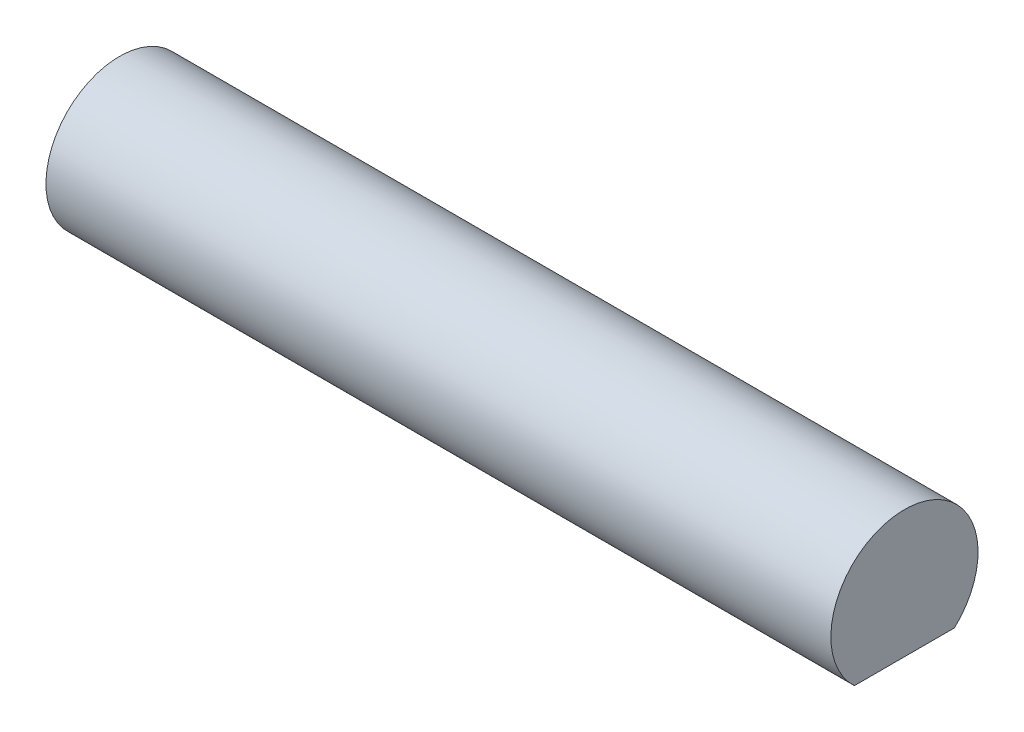
from build123d import *

# Parameters (mm, degrees)
BOSS_EXTRUDE1_DEPTH = 8


with BuildPart() as part:
    # Sketch1 → Boss-Extrude1 (new, symmetric)
    with BuildSketch(Plane(origin=(0, 0, 0), x_dir=(0, 0, -1), z_dir=(1, 0, 0))):
        with BuildLine():
            Line((-1.019803903, -1.1), (1.019803903, -1.1))
            ThreePointArc((1.019803903, -1.1), (1.374719218, -0.600122548), (1.5, 0))
            ThreePointArc((1.5, 0), (-0.600122548, 1.374719218), (-1.019803903, -1.1))
        make_face()
    extrude(amount=BOSS_EXTRUDE1_DEPTH, both=True)


solid = part.part
